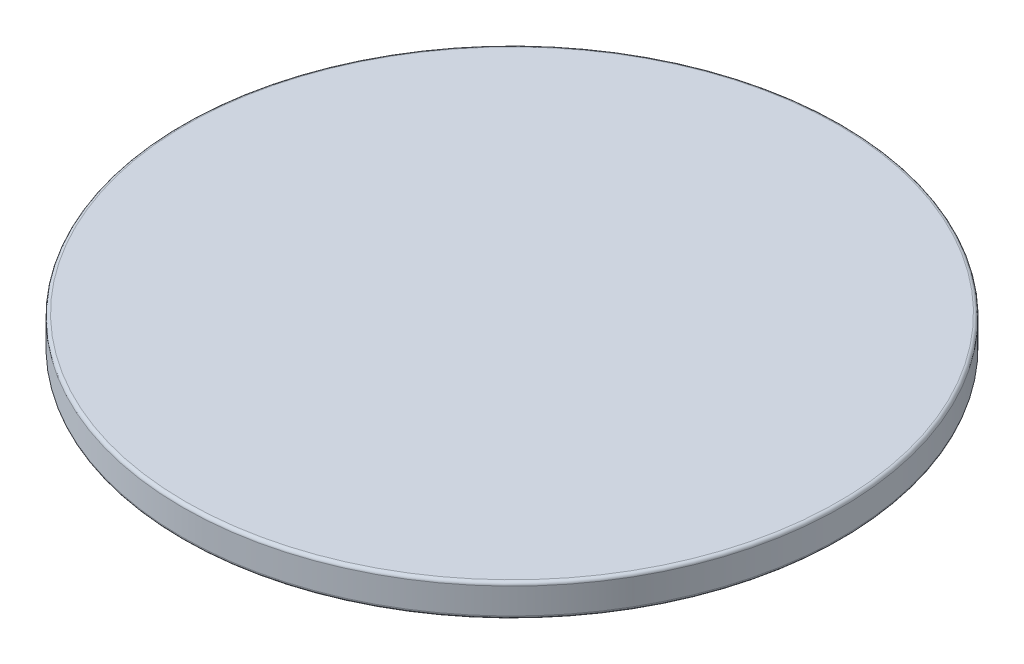
from build123d import *

# Parameters (mm, degrees)
SKETCH2_R           = 64.77
BOSS_EXTRUDE1_DEPTH = 6.35
FILLET1_R           = 0.635


with BuildPart() as part:
    # Sketch2 → Boss-Extrude1 (new body)
    with BuildSketch(Plane(origin=(0, 0, 0), x_dir=(1, 0, 0), z_dir=(0, 1, 0))):
        with Locations(Location((0, 0, 0), (0, 0, 270))):
            Circle(SKETCH2_R)
    extrude(amount=BOSS_EXTRUDE1_DEPTH)

    # Fillet1
    fillet1_edges = [part.edges().sort_by_distance(p)[0] for p in [
        (0, 0, -64.77),
        (0, 6.35, -64.77),
    ]]
    fillet(fillet1_edges, radius=FILLET1_R)


solid = part.part
